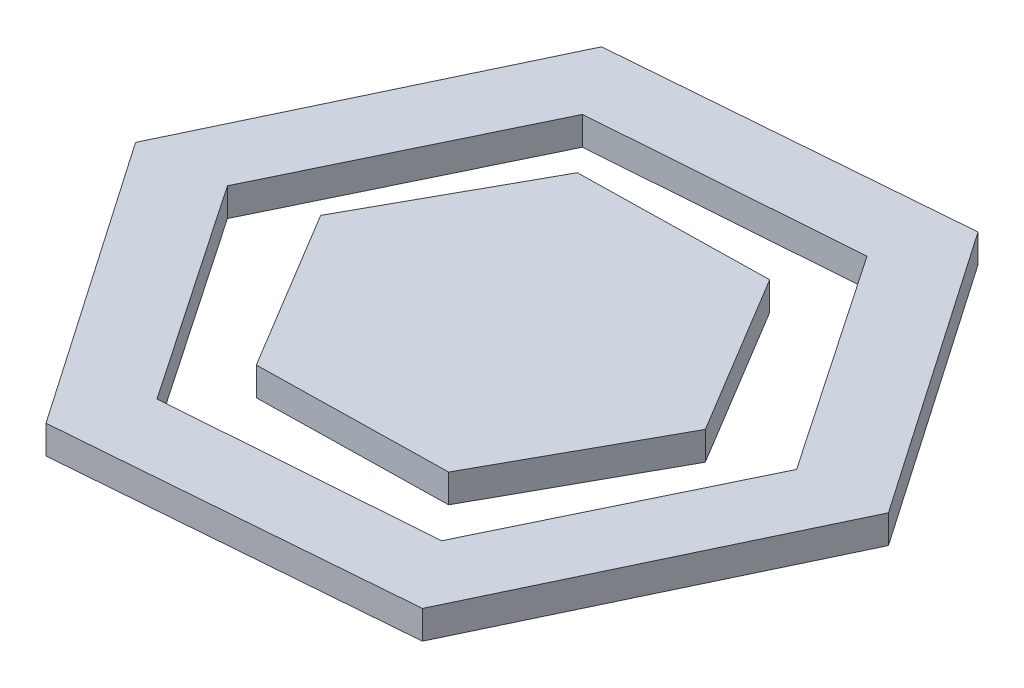
from build123d import *

# Parameters (mm, degrees)
BOSS_EXTRUDE1_DEPTH = 0.3
BOSS_EXTRUDE2_DEPTH = 0.3


with BuildPart() as part:
    # Sketch1 → Boss-Extrude1 (new body)
    with BuildSketch(Plane(origin=(0, 0, 0), x_dir=(1, 0, 0), z_dir=(0, 1, 0))):
        Polygon((-19.618957041, 20.240683804), (-18.032649715, 23.576605395), (-20.128488895, 26.618348634), (-23.810635401, 26.324170281), (-25.396942728, 22.98824869), (-23.301103548, 19.946505451), align=None)
        Polygon((-20.136429104, 20.960344021), (-18.914629777, 23.488291552), (-20.492996894, 25.810374573), (-23.293163338, 25.604510064), (-24.514962666, 23.076562533), (-22.936595549, 20.754479512), align=None, mode=Mode.SUBTRACT)
    extrude(amount=BOSS_EXTRUDE1_DEPTH)


with BuildPart() as body_2:
    # Sketch3 → Boss-Extrude2 (new body)
    with BuildSketch(Plane(origin=(0, 0, 0), x_dir=(1, 0, 0), z_dir=(0, 1, 0))):
        Polygon((-20.72810566, 21.626559942), (-19.762728669, 23.372443274), (-20.792019491, 25.081425938), (-22.786687304, 25.044525271), (-23.752064295, 23.298641939), (-22.722773473, 21.589659274), align=None)
    extrude(amount=BOSS_EXTRUDE2_DEPTH)


solid = Compound([part.part, body_2.part])
